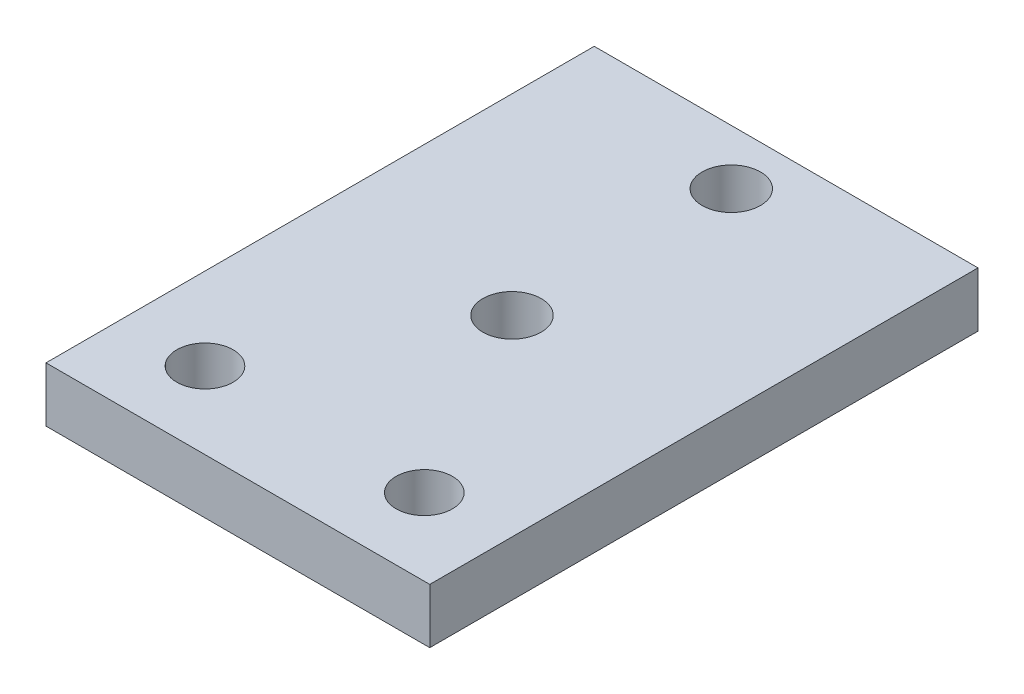
from build123d import *

# Parameters (mm, degrees)
SKETCH1_W               = 44.45
SKETCH1_H               = 63.5
BOSS_EXTRUDE1_DEPTH     = 6.35
F_1_4_CLEARANCE_HOLE1_D = 6.7564
F_1_4_CLEARANCE_HOLE3_D = 6.5278


with BuildPart() as part:
    # Sketch1 → Boss-Extrude1 (new body)
    with BuildSketch(Plane(origin=(0, 0, 0), x_dir=(1, 0, 0), z_dir=(0, 1, 0))):
        Rectangle(SKETCH1_W, SKETCH1_H)
    extrude(amount=BOSS_EXTRUDE1_DEPTH)

    # 1/4 Clearance Hole1 (through all)
    with Locations(Plane(origin=(0, 6.35, 0), x_dir=(1, 0, 0), z_dir=(0, 1, 0))):
        with Locations((0, 25.4), (0, 0)):
            Hole(F_1_4_CLEARANCE_HOLE1_D / 2)

    # 1/4 Clearance Hole3 (through all)
    with Locations(Plane(origin=(0, 6.35, 0), x_dir=(1, 0, 0), z_dir=(0, 1, 0))):
        with Locations((-12.7, -22.86), (12.7, -22.86)):
            Hole(F_1_4_CLEARANCE_HOLE3_D / 2)


solid = part.part
